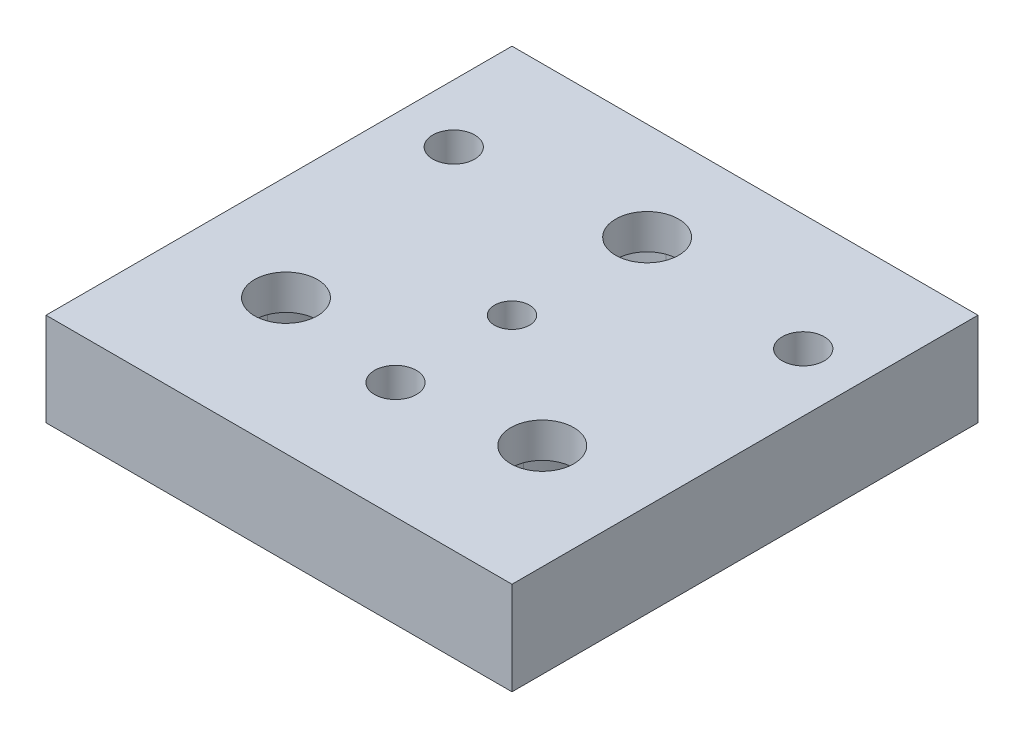
from build123d import *

# Parameters (mm, degrees)
SKETCH1_W           = 50.8
SKETCH1_H           = 50.8
BOSS_EXTRUDE1_DEPTH = 10.16
SKETCH2_R           = 2.286
CUT_EXTRUDE1_DEPTH  = 38.33022368
SKETCH3_R           = 3.429
CUT_EXTRUDE2_DEPTH  = 6.35
SKETCH4_R           = 3.429
CUT_EXTRUDE3_DEPTH  = 38.33022368
SKETCH5_R           = 1.905
CUT_EXTRUDE5_DEPTH  = 38.33022368


with BuildPart() as part:
    # Sketch1 → Boss-Extrude1 (new body)
    with BuildSketch(Plane(origin=(0, 0, 0), x_dir=(1, 0, 0), z_dir=(0, 1, 0))):
        Rectangle(SKETCH1_W, SKETCH1_H)
    extrude(amount=BOSS_EXTRUDE1_DEPTH)

    # Sketch2 → Cut-Extrude1 (cut, through all)
    with BuildSketch(Plane(origin=(0, 10.16, 0), x_dir=(1, 0, 0), z_dir=(0, 1, 0))):
        with Locations(Location((-19.05, 12.7, 0), (0, 0, 270))):
            Circle(SKETCH2_R)
        with Locations(Location((19.05, 12.7, 0), (0, 0, 270))):
            Circle(SKETCH2_R)
        with Locations(Location((0, -12.7, 0), (0, 0, 270))):
            Circle(SKETCH2_R)
    extrude(amount=-CUT_EXTRUDE1_DEPTH, mode=Mode.SUBTRACT)

    # Sketch3 → Cut-Extrude2 (cut)
    # profile 1 of 3: a face of its own
    with BuildSketch(Plane.XZ):
        with BuildLine():
            Line((-6.35, 16.256), (-6.35, 5.08))
            ThreePointArc((-6.35, 5.08), (-13.97, -2.54), (-21.59, 5.08))
            Line((-21.59, 5.08), (-21.59, 16.256))
            ThreePointArc((-21.59, 16.256), (-13.97, 23.876), (-6.35, 16.256))
        make_face()
        with Locations(Location((-13.97, 10.668, 0), (0, 0, 270))):
            Circle(SKETCH3_R, mode=Mode.SUBTRACT)
    # profile 2 of 3: a face of its own
    with BuildSketch(Plane.XZ):
        with BuildLine():
            Line((21.59, 16.256), (21.59, 5.08))
            ThreePointArc((21.59, 5.08), (13.97, -2.54), (6.35, 5.08))
            Line((6.35, 5.08), (6.35, 16.256))
            ThreePointArc((6.35, 16.256), (13.97, 23.876), (21.59, 16.256))
        make_face()
        with Locations(Location((13.97, 10.668, 0), (0, 0, 270))):
            Circle(SKETCH3_R, mode=Mode.SUBTRACT)
    # profile 3 of 3: a face of its own
    with BuildSketch(Plane.XZ):
        with BuildLine():
            Line((-5.588, -7.112), (5.588, -7.112))
            ThreePointArc((5.588, -7.112), (13.208, -14.732), (5.588, -22.352))
            Line((5.588, -22.352), (-5.588, -22.352))
            ThreePointArc((-5.588, -22.352), (-13.208, -14.732), (-5.588, -7.112))
        make_face()
        with Locations(Location((0, -14.732, 0), (0, 0, 270))):
            Circle(SKETCH3_R, mode=Mode.SUBTRACT)
    extrude(amount=-CUT_EXTRUDE2_DEPTH, mode=Mode.SUBTRACT)

    # Sketch4 → Cut-Extrude3 (cut, through all)
    with BuildSketch(Plane(origin=(0, 0, 0), x_dir=(-1, 0, 0), z_dir=(0, -1, 0))):
        with Locations(Location((13.97, -10.668, 0), (0, 0, 90))):
            Circle(SKETCH4_R)
        with Locations(Location((-13.97, -10.668, 0), (0, 0, 90))):
            Circle(SKETCH4_R)
        with Locations(Location((0, 14.732, 0), (0, 0, 90))):
            Circle(SKETCH4_R)
    extrude(amount=-CUT_EXTRUDE3_DEPTH, mode=Mode.SUBTRACT)

    # Sketch5 → Cut-Extrude5 (cut, through all)
    with BuildSketch(Plane(origin=(0, 10.16, 0), x_dir=(1, 0, 0), z_dir=(0, 1, 0))):
        with Locations(Location((0, 0, 0), (0, 0, 270))):
            Circle(SKETCH5_R)
    extrude(amount=-CUT_EXTRUDE5_DEPTH, mode=Mode.SUBTRACT)


solid = part.part
